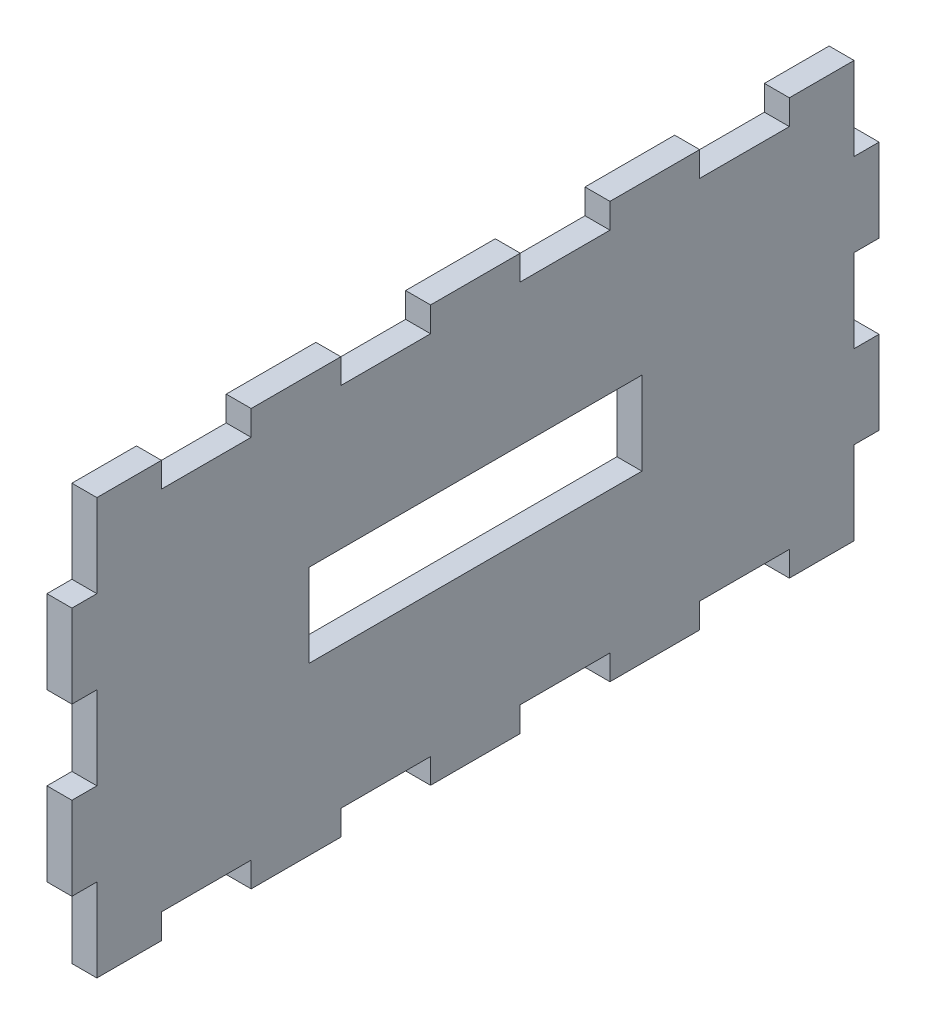
from build123d import *

# Parameters (mm, degrees)
ESBO_O1_W                = 97
ESBO_O1_H                = 50
RESSALTO_EXTRUS_O1_DEPTH = 3
CORTE_EXTRUS_O1_REACH    = 56.647
ESBO_O2_W                = 10.782222222
ESBO_O2_H                = 3
CORTE_EXTRUS_O2_REACH    = 56.647
ESBO_O4_W                = 3
ESBO_O4_H                = 10
CORTE_EXTRUS_O5_REACH    = 56.647
ESBO_O3_W                = 40
ESBO_O3_H                = 10


with BuildPart() as part:
    # Esboço1 → Ressalto-extrusão1 (new body)
    with BuildSketch(Plane(origin=(0, 0, 0), x_dir=(0, 0, -1), z_dir=(1, 0, 0))):
        Rectangle(ESBO_O1_W, ESBO_O1_H)
    extrude(amount=RESSALTO_EXTRUS_O1_DEPTH)

    # Esboço2 → Corte-extrusão1 (cut, up to next)
    with BuildSketch(Plane.ZY, mode=Mode.PRIVATE) as corte_extrus_o1_sk1:
        with Locations((-10.771111111, 23.5)):
            Rectangle(ESBO_O2_W, ESBO_O2_H)
    corte_extrus_o1_tool1 = extrude(corte_extrus_o1_sk1.sketch, amount=-CORTE_EXTRUS_O1_REACH, mode=Mode.PRIVATE) & part.part
    # Esboço2 → Corte-extrusão1 (cut, up to next)
    with BuildSketch(Plane.ZY, mode=Mode.PRIVATE) as corte_extrus_o1_sk2:
        with Locations((-32.331111111, 23.5)):
            Rectangle(ESBO_O2_W, ESBO_O2_H)
    corte_extrus_o1_tool2 = extrude(corte_extrus_o1_sk2.sketch, amount=-CORTE_EXTRUS_O1_REACH, mode=Mode.PRIVATE) & part.part
    # Esboço2 → Corte-extrusão1 (cut, up to next)
    with BuildSketch(Plane.ZY, mode=Mode.PRIVATE) as corte_extrus_o1_sk3:
        with Locations((10.788888889, 23.5)):
            Rectangle(ESBO_O2_W, ESBO_O2_H)
    corte_extrus_o1_tool3 = extrude(corte_extrus_o1_sk3.sketch, amount=-CORTE_EXTRUS_O1_REACH, mode=Mode.PRIVATE) & part.part
    # Esboço2 → Corte-extrusão1 (cut, up to next)
    with BuildSketch(Plane.ZY, mode=Mode.PRIVATE) as corte_extrus_o1_sk4:
        with Locations((32.348888889, 23.5)):
            Rectangle(ESBO_O2_W, ESBO_O2_H)
    corte_extrus_o1_tool4 = extrude(corte_extrus_o1_sk4.sketch, amount=-CORTE_EXTRUS_O1_REACH, mode=Mode.PRIVATE) & part.part
    # Esboço2 → Corte-extrusão1 (cut, up to next)
    with BuildSketch(Plane.ZY, mode=Mode.PRIVATE) as corte_extrus_o1_sk5:
        with Locations((-32.331111111, -23.5)):
            Rectangle(ESBO_O2_W, ESBO_O2_H)
    corte_extrus_o1_tool5 = extrude(corte_extrus_o1_sk5.sketch, amount=-CORTE_EXTRUS_O1_REACH, mode=Mode.PRIVATE) & part.part
    # Esboço2 → Corte-extrusão1 (cut, up to next)
    with BuildSketch(Plane.ZY, mode=Mode.PRIVATE) as corte_extrus_o1_sk6:
        with Locations((32.348888889, -23.5)):
            Rectangle(ESBO_O2_W, ESBO_O2_H)
    corte_extrus_o1_tool6 = extrude(corte_extrus_o1_sk6.sketch, amount=-CORTE_EXTRUS_O1_REACH, mode=Mode.PRIVATE) & part.part
    # Esboço2 → Corte-extrusão1 (cut, up to next)
    with BuildSketch(Plane.ZY, mode=Mode.PRIVATE) as corte_extrus_o1_sk7:
        with Locations((-10.771111111, -23.5)):
            Rectangle(ESBO_O2_W, ESBO_O2_H)
    corte_extrus_o1_tool7 = extrude(corte_extrus_o1_sk7.sketch, amount=-CORTE_EXTRUS_O1_REACH, mode=Mode.PRIVATE) & part.part
    # Esboço2 → Corte-extrusão1 (cut, up to next)
    with BuildSketch(Plane.ZY, mode=Mode.PRIVATE) as corte_extrus_o1_sk8:
        with Locations((10.788888889, -23.5)):
            Rectangle(ESBO_O2_W, ESBO_O2_H)
    corte_extrus_o1_tool8 = extrude(corte_extrus_o1_sk8.sketch, amount=-CORTE_EXTRUS_O1_REACH, mode=Mode.PRIVATE) & part.part
    add(corte_extrus_o1_tool1.solids().sort_by_distance((0, 23.5, -10.771111))[0], mode=Mode.SUBTRACT)
    add(corte_extrus_o1_tool2.solids().sort_by_distance((0, 23.5, -32.331111))[0], mode=Mode.SUBTRACT)
    add(corte_extrus_o1_tool3.solids().sort_by_distance((0, 23.5, 10.788889))[0], mode=Mode.SUBTRACT)
    add(corte_extrus_o1_tool4.solids().sort_by_distance((0, 23.5, 32.348889))[0], mode=Mode.SUBTRACT)
    add(corte_extrus_o1_tool5.solids().sort_by_distance((0, -23.5, -32.331111))[0], mode=Mode.SUBTRACT)
    add(corte_extrus_o1_tool6.solids().sort_by_distance((0, -23.5, 32.348889))[0], mode=Mode.SUBTRACT)
    add(corte_extrus_o1_tool7.solids().sort_by_distance((0, -23.5, -10.771111))[0], mode=Mode.SUBTRACT)
    add(corte_extrus_o1_tool8.solids().sort_by_distance((0, -23.5, 10.788889))[0], mode=Mode.SUBTRACT)

    # Esboço4 → Corte-extrusão2 (cut, up to next)
    with BuildSketch(Plane.ZY, mode=Mode.PRIVATE) as corte_extrus_o2_sk1:
        with Locations((47, 20)):
            Rectangle(ESBO_O4_W, ESBO_O4_H)
    corte_extrus_o2_tool1 = extrude(corte_extrus_o2_sk1.sketch, amount=-CORTE_EXTRUS_O2_REACH, mode=Mode.PRIVATE) & part.part
    # Esboço4 → Corte-extrusão2 (cut, up to next)
    with BuildSketch(Plane.ZY, mode=Mode.PRIVATE) as corte_extrus_o2_sk2:
        with Locations((-47, -20)):
            Rectangle(ESBO_O4_W, ESBO_O4_H)
    corte_extrus_o2_tool2 = extrude(corte_extrus_o2_sk2.sketch, amount=-CORTE_EXTRUS_O2_REACH, mode=Mode.PRIVATE) & part.part
    # Esboço4 → Corte-extrusão2 (cut, up to next)
    with BuildSketch(Plane.ZY, mode=Mode.PRIVATE) as corte_extrus_o2_sk3:
        with Locations((-47, 20)):
            Rectangle(ESBO_O4_W, ESBO_O4_H)
    corte_extrus_o2_tool3 = extrude(corte_extrus_o2_sk3.sketch, amount=-CORTE_EXTRUS_O2_REACH, mode=Mode.PRIVATE) & part.part
    # Esboço4 → Corte-extrusão2 (cut, up to next)
    with BuildSketch(Plane.ZY, mode=Mode.PRIVATE) as corte_extrus_o2_sk4:
        with Locations((47, -20)):
            Rectangle(ESBO_O4_W, ESBO_O4_H)
    corte_extrus_o2_tool4 = extrude(corte_extrus_o2_sk4.sketch, amount=-CORTE_EXTRUS_O2_REACH, mode=Mode.PRIVATE) & part.part
    # Esboço4 → Corte-extrusão2 (cut, up to next)
    with BuildSketch(Plane.ZY, mode=Mode.PRIVATE) as corte_extrus_o2_sk5:
        with Locations((47, 0)):
            Rectangle(ESBO_O4_W, ESBO_O4_H)
    corte_extrus_o2_tool5 = extrude(corte_extrus_o2_sk5.sketch, amount=-CORTE_EXTRUS_O2_REACH, mode=Mode.PRIVATE) & part.part
    # Esboço4 → Corte-extrusão2 (cut, up to next)
    with BuildSketch(Plane.ZY, mode=Mode.PRIVATE) as corte_extrus_o2_sk6:
        with Locations((-47, 0)):
            Rectangle(ESBO_O4_W, ESBO_O4_H)
    corte_extrus_o2_tool6 = extrude(corte_extrus_o2_sk6.sketch, amount=-CORTE_EXTRUS_O2_REACH, mode=Mode.PRIVATE) & part.part
    add(corte_extrus_o2_tool1.solids().sort_by_distance((0, 20, 47))[0], mode=Mode.SUBTRACT)
    add(corte_extrus_o2_tool2.solids().sort_by_distance((0, -20, -47))[0], mode=Mode.SUBTRACT)
    add(corte_extrus_o2_tool3.solids().sort_by_distance((0, 20, -47))[0], mode=Mode.SUBTRACT)
    add(corte_extrus_o2_tool4.solids().sort_by_distance((0, -20, 47))[0], mode=Mode.SUBTRACT)
    add(corte_extrus_o2_tool5.solids().sort_by_distance((0, 0, 47))[0], mode=Mode.SUBTRACT)
    add(corte_extrus_o2_tool6.solids().sort_by_distance((0, 0, -47))[0], mode=Mode.SUBTRACT)

    # Esboço3 → Corte-extrusão5 (cut, up to next)
    with BuildSketch(Plane(origin=(0, 0, 0), x_dir=(0, 0, -1), z_dir=(1, 0, 0)), mode=Mode.PRIVATE) as corte_extrus_o5_sk1:
        Rectangle(ESBO_O3_W, ESBO_O3_H)
    corte_extrus_o5_tool1 = extrude(corte_extrus_o5_sk1.sketch, amount=CORTE_EXTRUS_O5_REACH, mode=Mode.PRIVATE) & part.part
    add(corte_extrus_o5_tool1.solids().sort_by_distance((0, 0, 0))[0], mode=Mode.SUBTRACT)


solid = part.part
